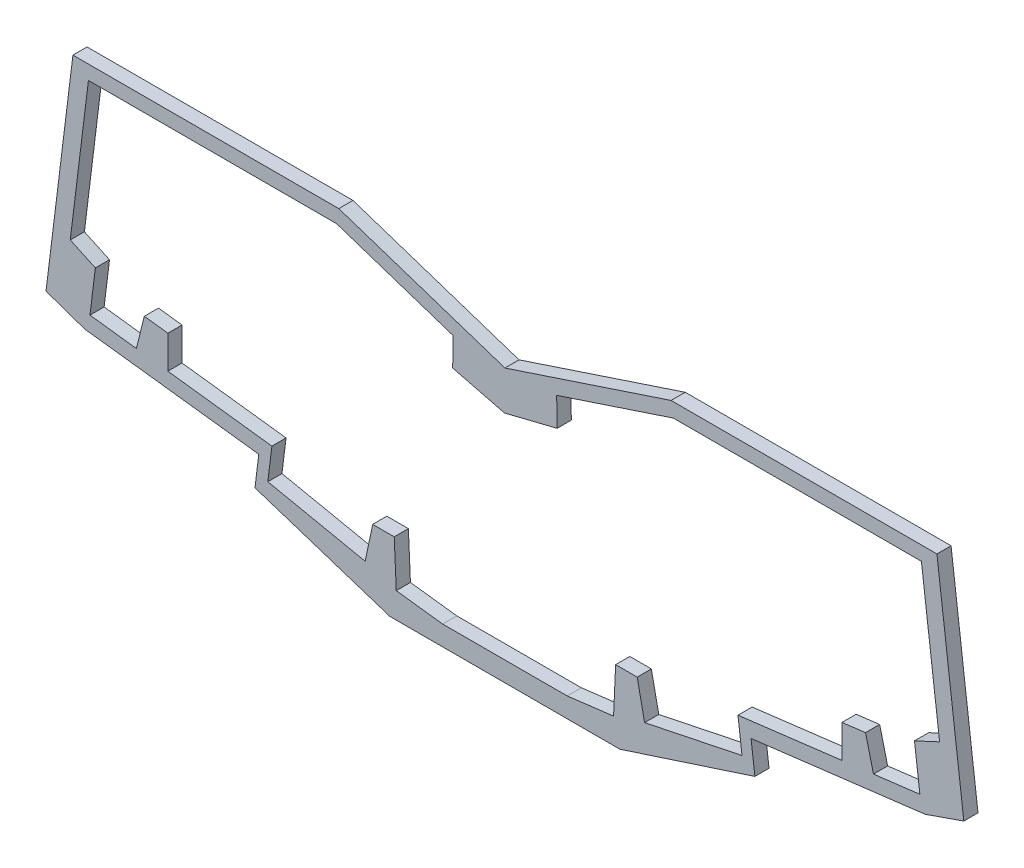
from build123d import *

# Parameters (mm, degrees)
EXTRUDE_2_DEPTH     = 5
CUT_EXTRUDE_5_DEPTH = 173.142382928


with BuildPart() as part:
    # Эскиз4 → Бобышка-Вытянуть2 (new body)
    with BuildSketch(Plane.XY):
        Polygon((152.5, 58), (58.64, 58), (0, 38.59), (-58.64, 58), (-152.5, 58), (-162, -18.92), (-148.354716995, -23.671565122), (-86.885994913, -31.21617284), (-88.237138959, -42.15617284), (-40.597138959, -57.662313559), (40.597138959, -57.662313559), (88.237138959, -42.15617284), (86.885994913, -31.21617284), (148.354716995, -23.671565122), (162, -18.92), align=None)
        with BuildLine():
            Line((21.848195141, 15.513282482), (18.617591482, 3.873282482))
            ThreePointArc((18.617591482, 3.873282482), (0, -28.455), (-18.617591482, 3.873282482))
            Line((-18.617591482, 3.873282482), (-21.848195141, 15.513282482))
            Line((-21.848195141, 15.513282482), (-10.908195141, 11.626317085))
            ThreePointArc((-10.908195141, 11.626317085), (0, 14.595), (10.908195141, 11.626317085))
            Line((10.908195141, 11.626317085), (21.848195141, 15.513282482))
        make_face(mode=Mode.SUBTRACT)
    extrude(amount=EXTRUDE_2_DEPTH)

    # Эскиз6 → Вырез-Вытянуть5 (cut, through all)
    with BuildSketch(Plane.XY.offset(5)):
        Polygon((-144.579383614, -3.098859092), (-153.441535305, 1.018454037), (-147.02155758, 53), (-59.446003505, 53), (-18.263209753, 39.3683829), (-18.443630735, 29.370010619), (-0.197288626, 24.750877673), (18.443630735, 29.370010619), (18.263209753, 39.3683829), (59.446003505, 53), (147.02155758, 53), (153.441535305, 1.018454037), (144.579383614, -3.098859092), (146.479275056, -18.481980118), (130.103694609, -20.504445202), (127.29501371, -9.23154094), (118.988149093, -10.257479758), (118.988149093, -21.877269986), (82.262397943, -26.413081686), (83.697009804, -38.028907412), (49.312411241, -45.164872427), (46.694846048, -32.552152466), (39.076267674, -32.552152466), (38.356972556, -48.649893027), (21.981392109, -50.672358111), (-21.981392109, -50.672358111), (-38.356972556, -48.649893027), (-39.076267674, -32.552152466), (-46.694846048, -32.552152466), (-49.312411241, -45.164872427), (-83.697009804, -38.028907412), (-82.262397943, -26.413081686), (-118.988149093, -21.877269986), (-118.988149093, -10.257479758), (-127.29501371, -9.23154094), (-130.103694609, -20.504445202), (-146.479275056, -18.481980118), align=None)
    extrude(amount=-CUT_EXTRUDE_5_DEPTH, mode=Mode.SUBTRACT)


solid = part.part
